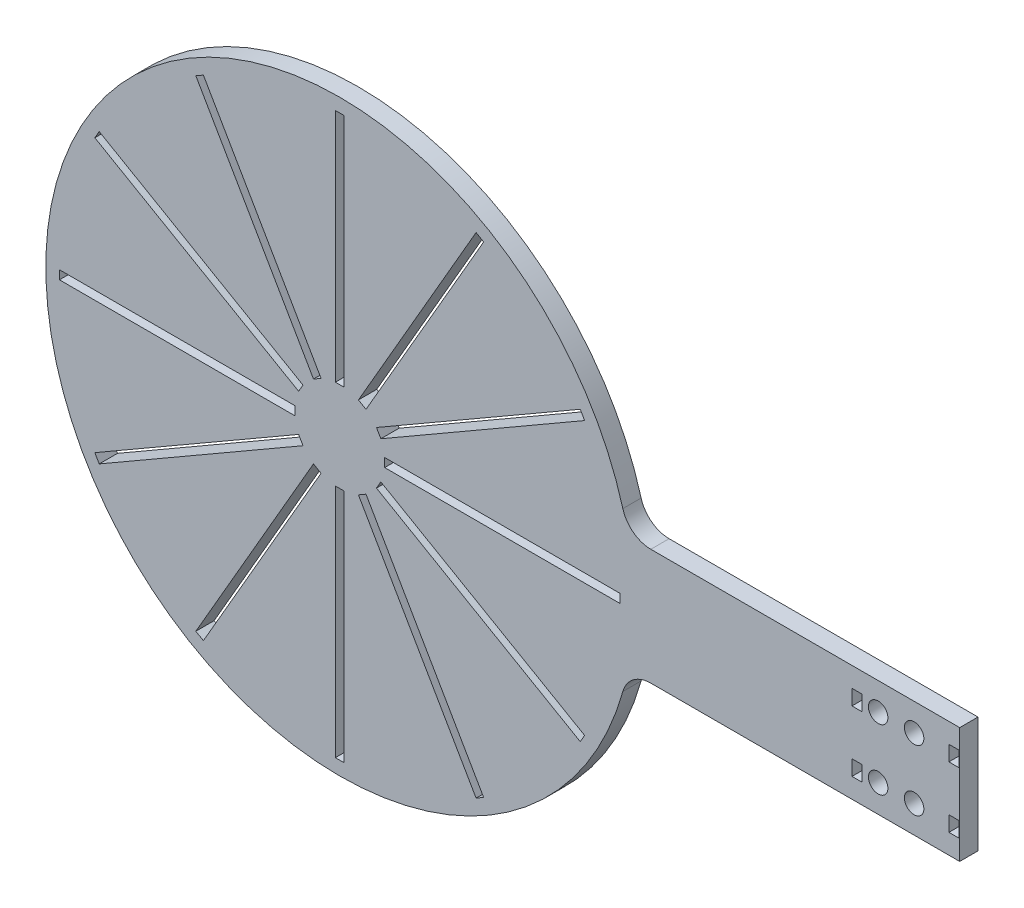
from build123d import *

# Parameters (mm, degrees)
SKETCH1_R                  = 96.35000288
BOSS_EXTRUDE1_DEPTH        = 6
SKETCH2_W                  = 2.86385
SKETCH2_H                  = 77.133562268
SKETCH2_W_2                = 77.133562268
SKETCH2_H_2                = 2.86385
CUT_EXTRUDE1_DEPTH         = 137.391517735
SKETCH3_W                  = 3.227804403
SKETCH3_H                  = 5
BOSS_EXTRUDE2_DEPTH        = 6
FILLET1_R                  = 9.525
F_6_4_6_4_DIAMETER_HOLE1_D = 6.4


with BuildPart() as part:
    # Sketch1 → Boss-Extrude1 (new body)
    with BuildSketch(Plane.XY):
        Circle(SKETCH1_R)
    extrude(amount=BOSS_EXTRUDE1_DEPTH)

    # Sketch2 → Cut-Extrude1 (cut, through all)
    with BuildSketch(Plane.XY.offset(6)):
        Polygon((6.122886862, 13.469001133), (44.689667996, 80.268625542), (47.169834848, 78.836700542), (8.603053714, 12.037076133), align=None)
        with Locations((0, 53.29272171)):
            Rectangle(SKETCH2_W, SKETCH2_H)
        Polygon((12.037076133, 8.603053714), (78.836700542, 47.169834848), (80.268625542, 44.689667996), (13.469001133, 6.122886862), align=None)
        with Locations((53.29272171, 0)):
            Rectangle(SKETCH2_W_2, SKETCH2_H_2)
        Polygon((13.469001133, -6.122886862), (80.268625542, -44.689667996), (78.836700542, -47.169834848), (12.037076133, -8.603053714), align=None)
        Polygon((8.603053714, -12.037076133), (47.169834848, -78.836700542), (44.689667996, -80.268625542), (6.122886862, -13.469001133), align=None)
        with Locations((0, -53.29272171)):
            Rectangle(SKETCH2_W, SKETCH2_H)
        Polygon((-6.122886862, -13.469001133), (-44.689667996, -80.268625542), (-47.169834848, -78.836700542), (-8.603053714, -12.037076133), align=None)
        Polygon((-12.037076133, -8.603053714), (-78.836700542, -47.169834848), (-80.268625542, -44.689667996), (-13.469001133, -6.122886862), align=None)
        with Locations((-53.29272171, 0)):
            Rectangle(SKETCH2_W_2, SKETCH2_H_2)
        Polygon((-13.469001133, 6.122886862), (-80.268625542, 44.689667996), (-78.836700542, 47.169834848), (-12.037076133, 8.603053714), align=None)
        Polygon((-8.603053714, 12.037076133), (-47.169834848, 78.836700542), (-44.689667996, 80.268625542), (-6.122886862, 13.469001133), align=None)
    extrude(amount=-CUT_EXTRUDE1_DEPTH, mode=Mode.SUBTRACT)

    # Sketch3 → Boss-Extrude2 (add)
    with BuildSketch(Plane.XY):
        with BuildLine():
            Line((203.2, 19), (94.45804918, 19))
            ThreePointArc((94.45804918, 19), (96.35000288, 0), (94.45804918, -19))
            Line((94.45804918, -19), (203.2, -19))
            Line((203.2, -19), (203.2, 19))
        make_face()
        with Locations((169.513902202, 10)):
            Rectangle(SKETCH3_W, SKETCH3_H, mode=Mode.SUBTRACT)
        with Locations((169.513902202, -10)):
            Rectangle(SKETCH3_W, SKETCH3_H, mode=Mode.SUBTRACT)
        with Locations((201.278368296, 10)):
            Rectangle(SKETCH3_W, SKETCH3_H, mode=Mode.SUBTRACT)
        with Locations((201.278368296, -10)):
            Rectangle(SKETCH3_W, SKETCH3_H, mode=Mode.SUBTRACT)
    extrude(amount=BOSS_EXTRUDE2_DEPTH)

    # Fillet1
    fillet1_edges = [part.edges().sort_by_distance(p)[0] for p in [
        (94.45804918, -19, 3),
        (94.45804918, 19, 3),
    ]]
    fillet(fillet1_edges, radius=FILLET1_R)

    # Ø6.4 (6.4) Diameter Hole1 (through all)
    with Locations(Plane.XY.offset(6)):
        with Locations((188.25889108, -10), (176.473462737, -10), (176.473462737, 10), (188.25889108, 10)):
            Hole(F_6_4_6_4_DIAMETER_HOLE1_D / 2)


solid = part.part
